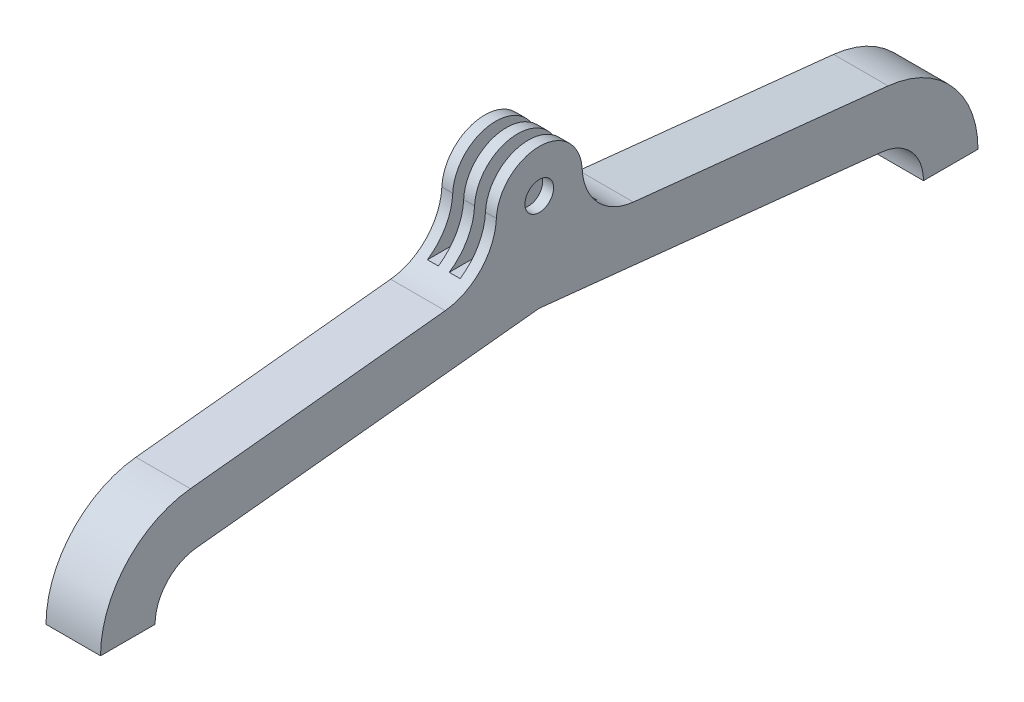
from build123d import *

# Parameters (mm, degrees)
SKETCH2_W           = 38.1
SKETCH2_H           = 38.1
SKETCH3_R           = 10
BOSS_EXTRUDE1_DEPTH = 38.1
FILLET1_R           = 40
SKETCH4_W           = 7.62
SKETCH4_H           = 59.936155674
SKETCH4_H_2         = 35.777885711
CUT_EXTRUDE1_DEPTH  = 60


with BuildPart() as part:
    # Sweep1: sweep along a path in Sketch1
    with BuildLine(Plane(origin=(0, 0, 0), x_dir=(0, 0, -1), z_dir=(1, 0, 0))) as sweep1_path:
        ThreePointArc((0, 0), (13.120743049, 34.179685259), (45.742360428, 50.8))
        Line((45.742360428, 50.8), (287.5, 76.2))
        Line((287.5, 76.2), (529.257639572, 50.8))
        ThreePointArc((529.257639572, 50.8), (561.879256951, 34.179685259), (575, 0))
    # Sketch2 → Sweep1 (sweep)
    with BuildSketch(Plane(origin=(0, 0, 0), x_dir=(1, 0, 0), z_dir=(0, 1, 0))):
        Rectangle(SKETCH2_W, SKETCH2_H)
    sweep(path=sweep1_path.line, transition=Transition.RIGHT)

    # Sketch3 → Boss-Extrude1 (add)
    with BuildSketch(Plane(origin=(19.05, 0, 0), x_dir=(0, 0, -1), z_dir=(1, 0, 0))):
        with BuildLine():
            ThreePointArc((317.5, 125), (267.165990691, 147.057381201), (285.064795638, 95.099000356))
            Line((285.064795638, 95.099000356), (287.5, 95.354852419))
            Line((287.5, 95.354852419), (289.935204362, 95.099000356))
            ThreePointArc((289.935204362, 95.099000356), (309.557381201, 104.665990691), (317.5, 125))
        make_face()
        with Locations((287.5, 125)):
            Circle(SKETCH3_R, mode=Mode.SUBTRACT)
    extrude(amount=-BOSS_EXTRUDE1_DEPTH)

    # Fillet1
    fillet1_edges = [part.edges().sort_by_distance(p)[0] for p in [
        (0, 95.099000356, -289.935204362),
        (0, 95.099000356, -285.064795638),
    ]]
    fillet(fillet1_edges, radius=FILLET1_R)

    # Sketch4 → Cut-Extrude1 (cut)
    with BuildSketch(Plane(origin=(0, 155, 0), x_dir=(1, 0, 0), z_dir=(0, 1, 0))):
        with Locations((-7.62, 287.5)):
            Rectangle(SKETCH4_W, SKETCH4_H)
        with Locations((-7.62, 335.357020692)):
            Rectangle(SKETCH4_W, SKETCH4_H_2)
        with Locations((7.62, 335.357020692)):
            Rectangle(SKETCH4_W, SKETCH4_H_2)
        with Locations((7.62, 287.5)):
            Rectangle(SKETCH4_W, SKETCH4_H)
        with Locations((7.62, 239.642979308)):
            Rectangle(SKETCH4_W, SKETCH4_H_2)
        with Locations((-7.62, 239.642979308)):
            Rectangle(SKETCH4_W, SKETCH4_H_2)
    extrude(amount=-CUT_EXTRUDE1_DEPTH, mode=Mode.SUBTRACT)


solid = part.part
